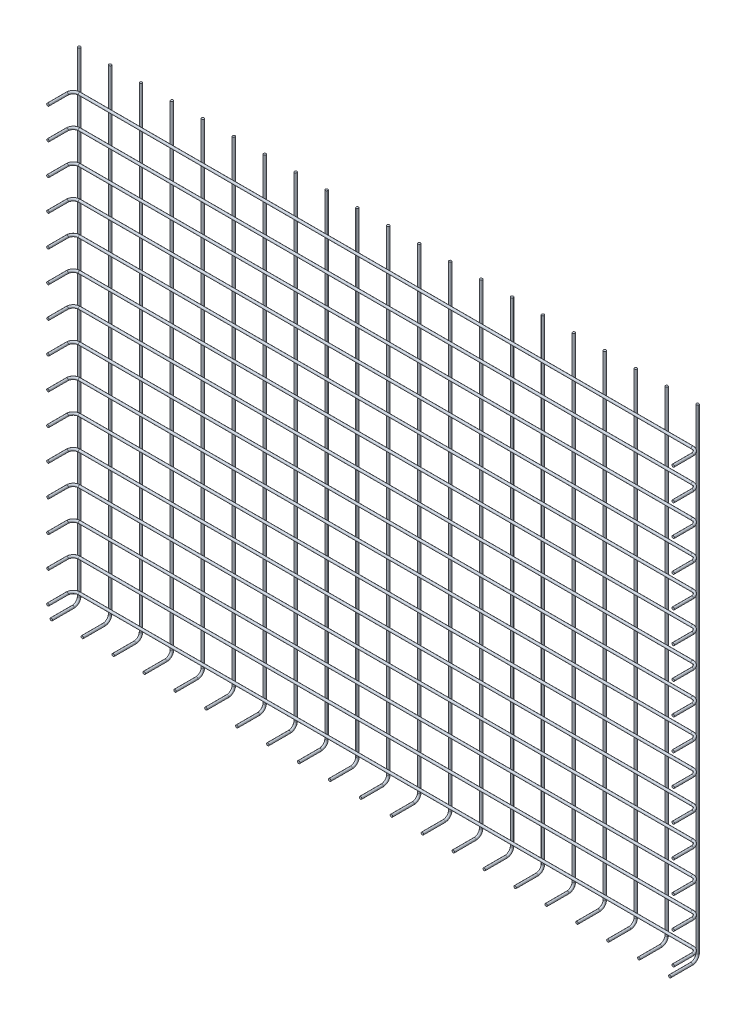
from build123d import *

# Parameters (mm, degrees)
SKETCH_1_R             = 2
PATTERN_LINEAR_2_COUNT = 11
PATTERN_LINEAR_2_PITCH = 50
SKETCH_4_R             = 2
PATTERN_LINEAR_3_COUNT = 15
PATTERN_LINEAR_3_PITCH = 50


with BuildPart() as part:
    # По траектории1: sweep along a path in Эскиз2
    with BuildLine(Plane(origin=(0, 0, 0), x_dir=(0, 0, -1), z_dir=(1, 0, 0))) as sweep_1_path:
        Line((-47, 2), (-12, 2))
        ThreePointArc((-12, 2), (-4.928932188, 4.928932188), (-2, 12))
        Line((-2, 12), (-2, 781.056624327))
    # Эскиз1 → По траектории1 (sweep)
    with BuildSketch(Plane.XY.offset(47)):
        with Locations((0, 2)):
            Circle(SKETCH_1_R)
    sweep(path=sweep_1_path.line)


with BuildPart() as pattern_linear_2_1:
    # Линейный массив2: pattern copy
    add(part.part.moved(Location(Vector(1, 0, 0) * (1 * PATTERN_LINEAR_2_PITCH))))


with BuildPart() as pattern_linear_2_2:
    # Линейный массив2: pattern copy
    add(part.part.moved(Location(Vector(1, 0, 0) * (2 * PATTERN_LINEAR_2_PITCH))))


with BuildPart() as pattern_linear_2_3:
    # Линейный массив2: pattern copy
    add(part.part.moved(Location(Vector(1, 0, 0) * (3 * PATTERN_LINEAR_2_PITCH))))


with BuildPart() as pattern_linear_2_4:
    # Линейный массив2: pattern copy
    add(part.part.moved(Location(Vector(1, 0, 0) * (4 * PATTERN_LINEAR_2_PITCH))))


with BuildPart() as pattern_linear_2_5:
    # Линейный массив2: pattern copy
    add(part.part.moved(Location(Vector(1, 0, 0) * (5 * PATTERN_LINEAR_2_PITCH))))


with BuildPart() as pattern_linear_2_6:
    # Линейный массив2: pattern copy
    add(part.part.moved(Location(Vector(1, 0, 0) * (6 * PATTERN_LINEAR_2_PITCH))))


with BuildPart() as pattern_linear_2_7:
    # Линейный массив2: pattern copy
    add(part.part.moved(Location(Vector(1, 0, 0) * (7 * PATTERN_LINEAR_2_PITCH))))


with BuildPart() as pattern_linear_2_8:
    # Линейный массив2: pattern copy
    add(part.part.moved(Location(Vector(1, 0, 0) * (8 * PATTERN_LINEAR_2_PITCH))))


with BuildPart() as pattern_linear_2_9:
    # Линейный массив2: pattern copy
    add(part.part.moved(Location(Vector(1, 0, 0) * (9 * PATTERN_LINEAR_2_PITCH))))


with BuildPart() as pattern_linear_2_10:
    # Линейный массив2: pattern copy
    add(part.part.moved(Location(Vector(1, 0, 0) * (10 * PATTERN_LINEAR_2_PITCH))))


with BuildPart() as body_12:
    # Зеркальное отражение1: mirrored copy
    add(pattern_linear_2_10.part.mirror(Plane(origin=(0, 0, 0), x_dir=(0, 0, 1), z_dir=(1, 0, 0))))


with BuildPart() as body_13:
    # Mirror 1 2: mirrored copy
    add(pattern_linear_2_9.part.mirror(Plane(origin=(0, 0, 0), x_dir=(0, 0, 1), z_dir=(1, 0, 0))))


with BuildPart() as body_14:
    # Mirror 1 3: mirrored copy
    add(pattern_linear_2_8.part.mirror(Plane(origin=(0, 0, 0), x_dir=(0, 0, 1), z_dir=(1, 0, 0))))


with BuildPart() as body_15:
    # Mirror 1 4: mirrored copy
    add(pattern_linear_2_7.part.mirror(Plane(origin=(0, 0, 0), x_dir=(0, 0, 1), z_dir=(1, 0, 0))))


with BuildPart() as body_16:
    # Mirror 1 5: mirrored copy
    add(pattern_linear_2_6.part.mirror(Plane(origin=(0, 0, 0), x_dir=(0, 0, 1), z_dir=(1, 0, 0))))


with BuildPart() as body_17:
    # Mirror 1 6: mirrored copy
    add(pattern_linear_2_5.part.mirror(Plane(origin=(0, 0, 0), x_dir=(0, 0, 1), z_dir=(1, 0, 0))))


with BuildPart() as body_18:
    # Mirror 1 7: mirrored copy
    add(pattern_linear_2_4.part.mirror(Plane(origin=(0, 0, 0), x_dir=(0, 0, 1), z_dir=(1, 0, 0))))


with BuildPart() as body_19:
    # Mirror 1 8: mirrored copy
    add(pattern_linear_2_2.part.mirror(Plane(origin=(0, 0, 0), x_dir=(0, 0, 1), z_dir=(1, 0, 0))))


with BuildPart() as body_20:
    # Mirror 1 9: mirrored copy
    add(pattern_linear_2_1.part.mirror(Plane(origin=(0, 0, 0), x_dir=(0, 0, 1), z_dir=(1, 0, 0))))


with BuildPart() as body_21:
    # Mirror 1 10: mirrored copy
    add(pattern_linear_2_3.part.mirror(Plane(origin=(0, 0, 0), x_dir=(0, 0, 1), z_dir=(1, 0, 0))))


with BuildPart() as body_22:
    # По траектории2: sweep along a path in Эскиз3
    with BuildLine(Plane(origin=(0, 20, 0), x_dir=(1, 0, 0), z_dir=(0, 1, 0))) as sweep_2_path:
        Line((-505.5, -47), (-505.5, -16))
        ThreePointArc((-505.5, -16), (-502.571067812, -8.928932188), (-495.5, -6))
        Line((-495.5, -6), (495.5, -6))
        ThreePointArc((495.5, -6), (502.571067812, -8.928932188), (505.5, -16))
        Line((505.5, -16), (505.5, -47))
    # Эскиз4 → По траектории2 (sweep)
    with BuildSketch(Plane.XY.offset(47)):
        with Locations((-505.5, 20)):
            Circle(SKETCH_4_R)
    sweep(path=sweep_2_path.line)


with BuildPart() as pattern_linear_3_1:
    # Линейный массив3: pattern copy
    add(body_22.part.moved(Location(Vector(0, 1, 0) * (1 * PATTERN_LINEAR_3_PITCH))))


with BuildPart() as pattern_linear_3_2:
    # Линейный массив3: pattern copy
    add(body_22.part.moved(Location(Vector(0, 1, 0) * (2 * PATTERN_LINEAR_3_PITCH))))


with BuildPart() as pattern_linear_3_3:
    # Линейный массив3: pattern copy
    add(body_22.part.moved(Location(Vector(0, 1, 0) * (3 * PATTERN_LINEAR_3_PITCH))))


with BuildPart() as pattern_linear_3_4:
    # Линейный массив3: pattern copy
    add(body_22.part.moved(Location(Vector(0, 1, 0) * (4 * PATTERN_LINEAR_3_PITCH))))


with BuildPart() as pattern_linear_3_5:
    # Линейный массив3: pattern copy
    add(body_22.part.moved(Location(Vector(0, 1, 0) * (5 * PATTERN_LINEAR_3_PITCH))))


with BuildPart() as pattern_linear_3_6:
    # Линейный массив3: pattern copy
    add(body_22.part.moved(Location(Vector(0, 1, 0) * (6 * PATTERN_LINEAR_3_PITCH))))


with BuildPart() as pattern_linear_3_7:
    # Линейный массив3: pattern copy
    add(body_22.part.moved(Location(Vector(0, 1, 0) * (7 * PATTERN_LINEAR_3_PITCH))))


with BuildPart() as pattern_linear_3_8:
    # Линейный массив3: pattern copy
    add(body_22.part.moved(Location(Vector(0, 1, 0) * (8 * PATTERN_LINEAR_3_PITCH))))


with BuildPart() as pattern_linear_3_9:
    # Линейный массив3: pattern copy
    add(body_22.part.moved(Location(Vector(0, 1, 0) * (9 * PATTERN_LINEAR_3_PITCH))))


with BuildPart() as pattern_linear_3_10:
    # Линейный массив3: pattern copy
    add(body_22.part.moved(Location(Vector(0, 1, 0) * (10 * PATTERN_LINEAR_3_PITCH))))


with BuildPart() as pattern_linear_3_11:
    # Линейный массив3: pattern copy
    add(body_22.part.moved(Location(Vector(0, 1, 0) * (11 * PATTERN_LINEAR_3_PITCH))))


with BuildPart() as pattern_linear_3_12:
    # Линейный массив3: pattern copy
    add(body_22.part.moved(Location(Vector(0, 1, 0) * (12 * PATTERN_LINEAR_3_PITCH))))


with BuildPart() as pattern_linear_3_13:
    # Линейный массив3: pattern copy
    add(body_22.part.moved(Location(Vector(0, 1, 0) * (13 * PATTERN_LINEAR_3_PITCH))))


with BuildPart() as pattern_linear_3_14:
    # Линейный массив3: pattern copy
    add(body_22.part.moved(Location(Vector(0, 1, 0) * (14 * PATTERN_LINEAR_3_PITCH))))


solid = Compound([part.part, pattern_linear_2_1.part, pattern_linear_2_2.part, pattern_linear_2_3.part, pattern_linear_2_4.part, pattern_linear_2_5.part, pattern_linear_2_6.part, pattern_linear_2_7.part, pattern_linear_2_8.part, pattern_linear_2_9.part, pattern_linear_2_10.part, body_12.part, body_13.part, body_14.part, body_15.part, body_16.part, body_17.part, body_18.part, body_19.part, body_20.part, body_21.part, body_22.part, pattern_linear_3_1.part, pattern_linear_3_2.part, pattern_linear_3_3.part, pattern_linear_3_4.part, pattern_linear_3_5.part, pattern_linear_3_6.part, pattern_linear_3_7.part, pattern_linear_3_8.part, pattern_linear_3_9.part, pattern_linear_3_10.part, pattern_linear_3_11.part, pattern_linear_3_12.part, pattern_linear_3_13.part, pattern_linear_3_14.part])
